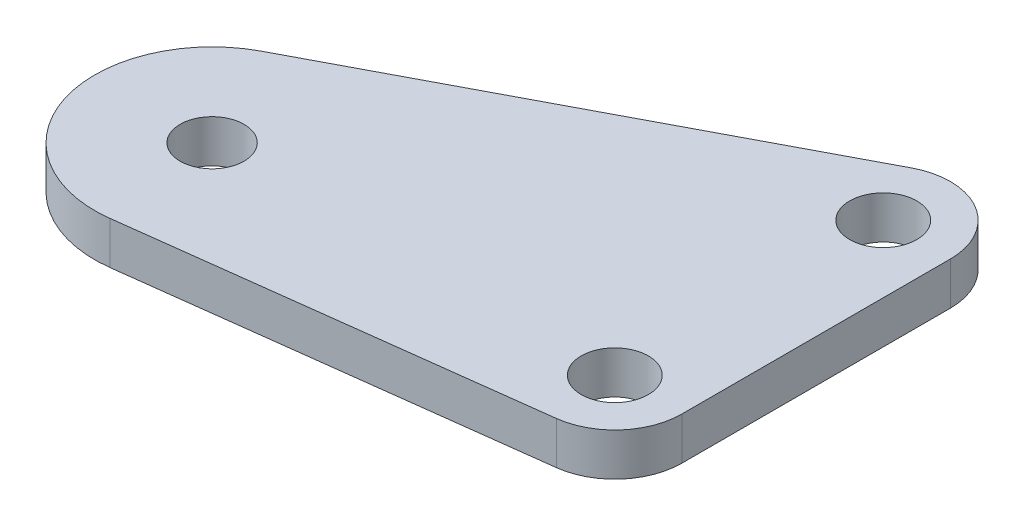
from build123d import *

# Parameters (mm, degrees)
SKETCH1_R           = 5
SKETCH1_R_2         = 4.7625
BOSS_EXTRUDE1_DEPTH = 6.35


with BuildPart() as part:
    # Sketch1 → Boss-Extrude1 (new body)
    with BuildSketch(Plane(origin=(0, 0, 0), x_dir=(1, 0, 0), z_dir=(0, 1, 0))):
        with BuildLine():
            Line((10, 40), (10, 0))
            ThreePointArc((10, 0), (7.5, -6.614378278), (1.25, -9.921567416))
            Line((1.25, -9.921567416), (-57.8125, -17.362742979))
            ThreePointArc((-57.8125, -17.362742979), (-76.694591069, -5.247916638), (-68.140184424, 15.491526637))
            Line((-68.140184424, 15.491526637), (-4.651533957, 48.852300935))
            ThreePointArc((-4.651533957, 48.852300935), (5.171298697, 48.559069446), (10, 40))
        make_face()
        with Locations(Location((0, 0, 0), (0, 0, 270))):
            Circle(SKETCH1_R, mode=Mode.SUBTRACT)
        with Locations(Location((0, 40, 0), (0, 0, 270))):
            Circle(SKETCH1_R, mode=Mode.SUBTRACT)
        with Locations(Location((-60, 0, 0), (0, 0, 270))):
            Circle(SKETCH1_R_2, mode=Mode.SUBTRACT)
    extrude(amount=-BOSS_EXTRUDE1_DEPTH)


solid = part.part
